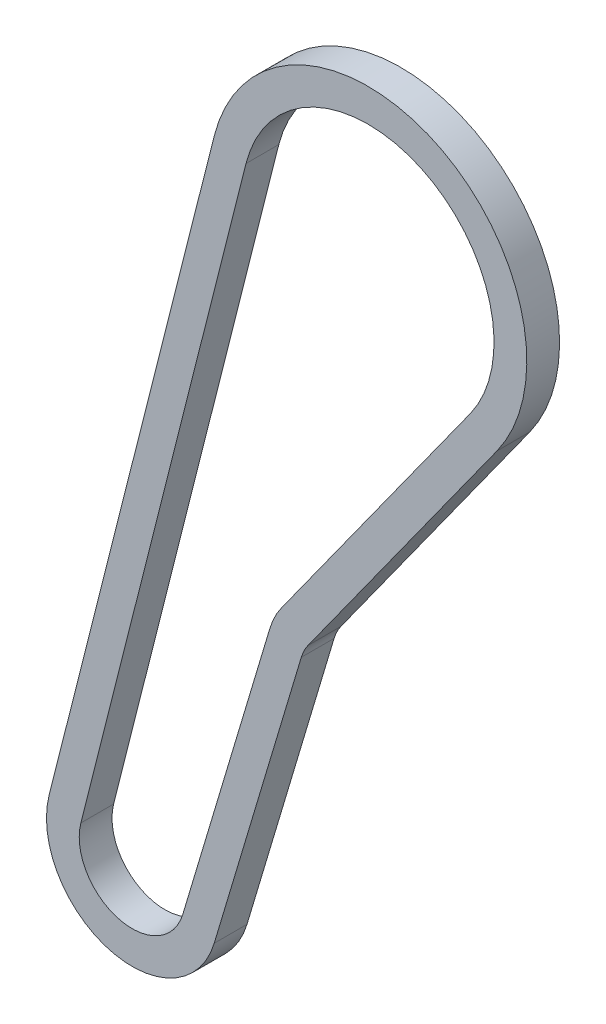
from build123d import *

# Parameters (mm, degrees)
EXTRUDE_THIN1_DEPTH = 5


with BuildPart() as part:
    # Sketch2 → Extrude-Thin1 (new body)
    with BuildSketch(Plane.XY):
        with BuildLine():
            Line((31.737189524, 49.429256179), (18.452031438, 5.005116936))
            ThreePointArc((18.452031438, 5.005116936), (2.455857834, -3.849946484), (-6.741752404, 11.951752286))
            Line((-6.741752404, 11.951752286), (18.457702948, 111.680824527))
            ThreePointArc((18.457702948, 111.680824527), (52.139902973, 127.701671453), (61.588984186, 91.620194226))
            Line((61.588984186, 91.620194226), (32.759580087, 51.509058335))
            ThreePointArc((32.759580087, 51.509058335), (32.16171614, 50.511761899), (31.737189524, 49.429256179))
        make_face()
        with BuildLine():
            Line((26.946810916, 50.86183176), (13.66165283, 6.437692517))
            ThreePointArc((13.66165283, 6.437692517), (3.784902946, 0.97018205), (-1.894111179, 10.726854512))
            Line((-1.894111179, 10.726854512), (23.305344172, 110.455926753))
            ThreePointArc((23.305344172, 110.455926753), (50.031286447, 123.168048581), (57.528884552, 94.538342776))
            Line((57.528884552, 94.538342776), (28.699480452, 54.427206885))
            ThreePointArc((28.699480452, 54.427206885), (27.674570829, 52.717555851), (26.946810916, 50.86183176))
        make_face(mode=Mode.SUBTRACT)
    extrude(amount=EXTRUDE_THIN1_DEPTH)


solid = part.part
